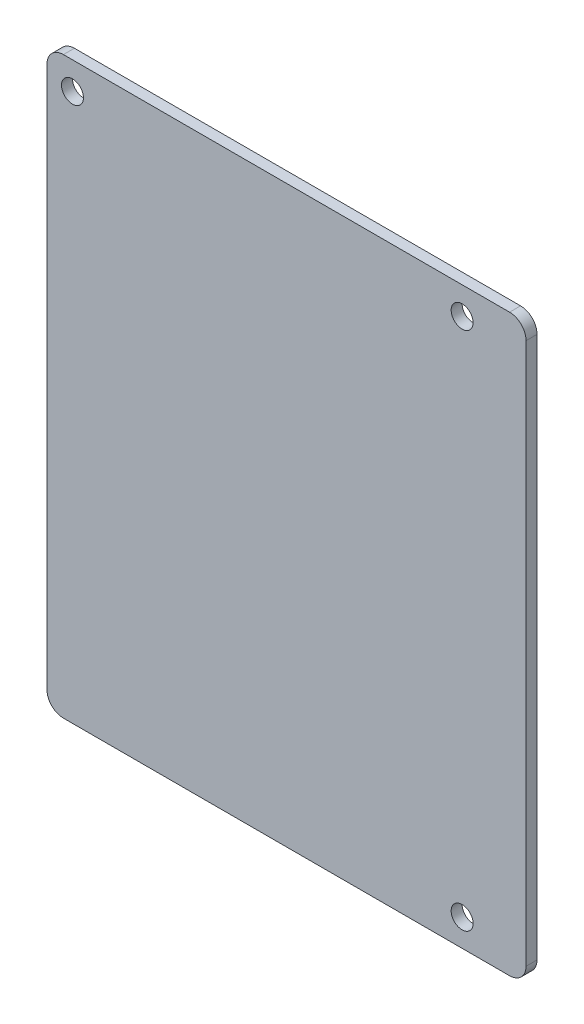
from build123d import *

# Parameters (mm, degrees)
EXTRUDE_1_DEPTH = 2
F_4_0MM_1_D     = 4


with BuildPart() as part:
    # 草图1 → 凸台-拉伸1 (new body)
    with BuildSketch(Plane.XY):
        with BuildLine():
            Line((-40.65, 52.36), (40.65, 52.36))
            ThreePointArc((40.65, 52.36), (42.771320344, 51.481320344), (43.65, 49.36))
            Line((43.65, 49.36), (43.65, -49.36))
            ThreePointArc((43.65, -49.36), (42.771320344, -51.481320344), (40.65, -52.36))
            Line((40.65, -52.36), (-40.65, -52.36))
            ThreePointArc((-40.65, -52.36), (-42.771320344, -51.481320344), (-43.65, -49.36))
            Line((-43.65, -49.36), (-43.65, 49.36))
            ThreePointArc((-43.65, 49.36), (-42.771320344, 51.481320344), (-40.65, 52.36))
        make_face()
    extrude(amount=EXTRUDE_1_DEPTH)

    # Ø4.0mm 暗销孔1 (through all)
    with Locations(Plane.XY.offset(2)):
        with Locations((-39, 47.36), (32, 47.36), (32, -47.44)):
            Hole(F_4_0MM_1_D / 2)


solid = part.part
